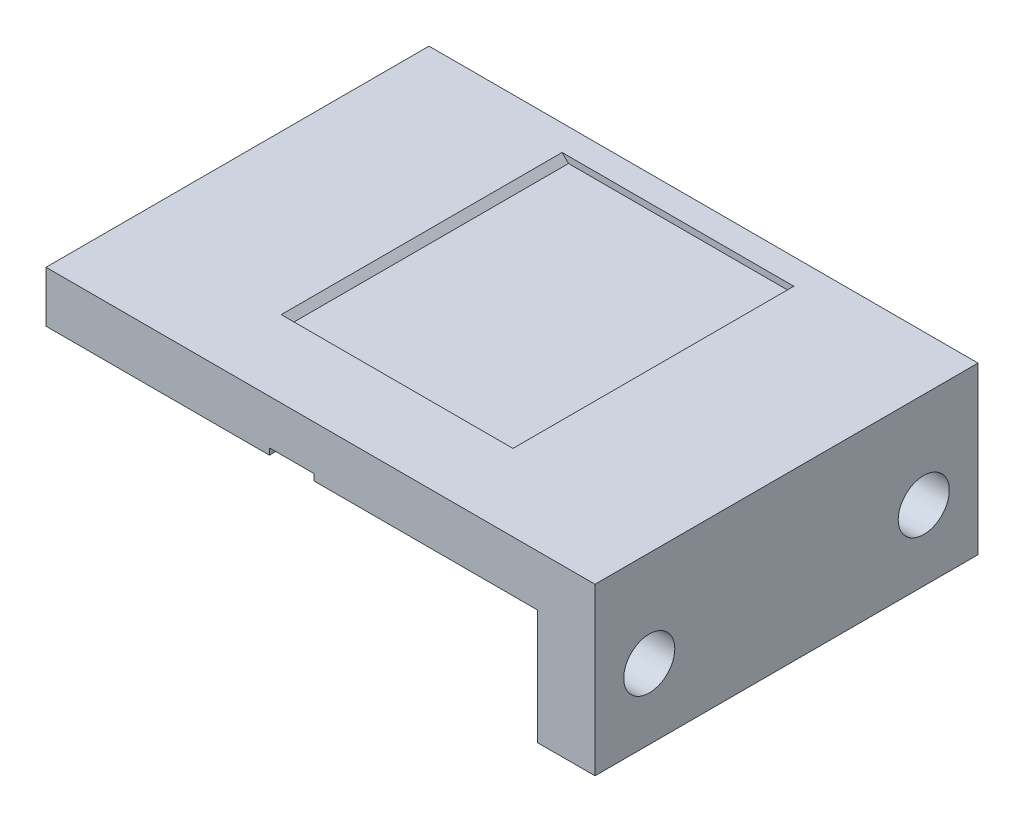
from build123d import *

# Parameters (mm, degrees)
SKETCH1_W               = 77
SKETCH1_H               = 60
BOSS_EXTRUDE1_DEPTH     = 8
SKETCH3_W               = 60
SKETCH3_H               = 26
BOSS_EXTRUDE2_DEPTH     = 9
SKETCH4_R               = 4
CUT_EXTRUDE2_DEPTH      = 107.395488626
SKETCH5_W               = 34.3
SKETCH5_H               = 44
RECESS_DEPTH            = 1
ANGLES_IN_RECESS_DEPTH  = 44
SKETCH7_W               = 7
SKETCH7_H               = 60
WHERE_THE_BELT_GO_DEPTH = 1


with BuildPart() as part:
    # Sketch1 → Boss-Extrude1 (new body)
    with BuildSketch(Plane(origin=(0, 0, 0), x_dir=(1, 0, 0), z_dir=(0, 1, 0))):
        with Locations((38.5, 30)):
            Rectangle(SKETCH1_W, SKETCH1_H)
    extrude(amount=BOSS_EXTRUDE1_DEPTH)

    # Sketch3 → Boss-Extrude2 (add)
    with BuildSketch(Plane(origin=(77, 0, 0), x_dir=(0, 0, -1), z_dir=(1, 0, 0))):
        with Locations((30, -5)):
            Rectangle(SKETCH3_W, SKETCH3_H)
    extrude(amount=BOSS_EXTRUDE2_DEPTH)

    # Sketch4 → Cut-Extrude2 (cut, through all)
    with BuildSketch(Plane(origin=(86, 0, 0), x_dir=(0, 0, -1), z_dir=(1, 0, 0))):
        with Locations((8.5, -7)):
            Circle(SKETCH4_R)
        with Locations(Location((51.5, -7, 0), (0, 0, 180))):
            Circle(SKETCH4_R)
    extrude(amount=-CUT_EXTRUDE2_DEPTH, mode=Mode.SUBTRACT)

    # Sketch5 → recess (cut)
    with BuildSketch(Plane(origin=(0, 8, 0), x_dir=(1, 0, 0), z_dir=(0, 1, 0))):
        with Locations((43, 34)):
            Rectangle(SKETCH5_W, SKETCH5_H)
    extrude(amount=-RECESS_DEPTH, mode=Mode.SUBTRACT)

    # Sketch6 → Angles in recess (cut)
    with BuildSketch(Plane.XY.offset(-56)):
        Polygon((25.85, 7), (24.85, 8), (25.85, 8), align=None)
        Polygon((60.15, 8), (60.15, 7), (61.15, 8), align=None)
    extrude(amount=ANGLES_IN_RECESS_DEPTH, mode=Mode.SUBTRACT)

    # Sketch7 → where the belt go (cut)
    with BuildSketch(Plane.XZ):
        with Locations((38.5, -30)):
            Rectangle(SKETCH7_W, SKETCH7_H)
    extrude(amount=-WHERE_THE_BELT_GO_DEPTH, mode=Mode.SUBTRACT)


solid = part.part
